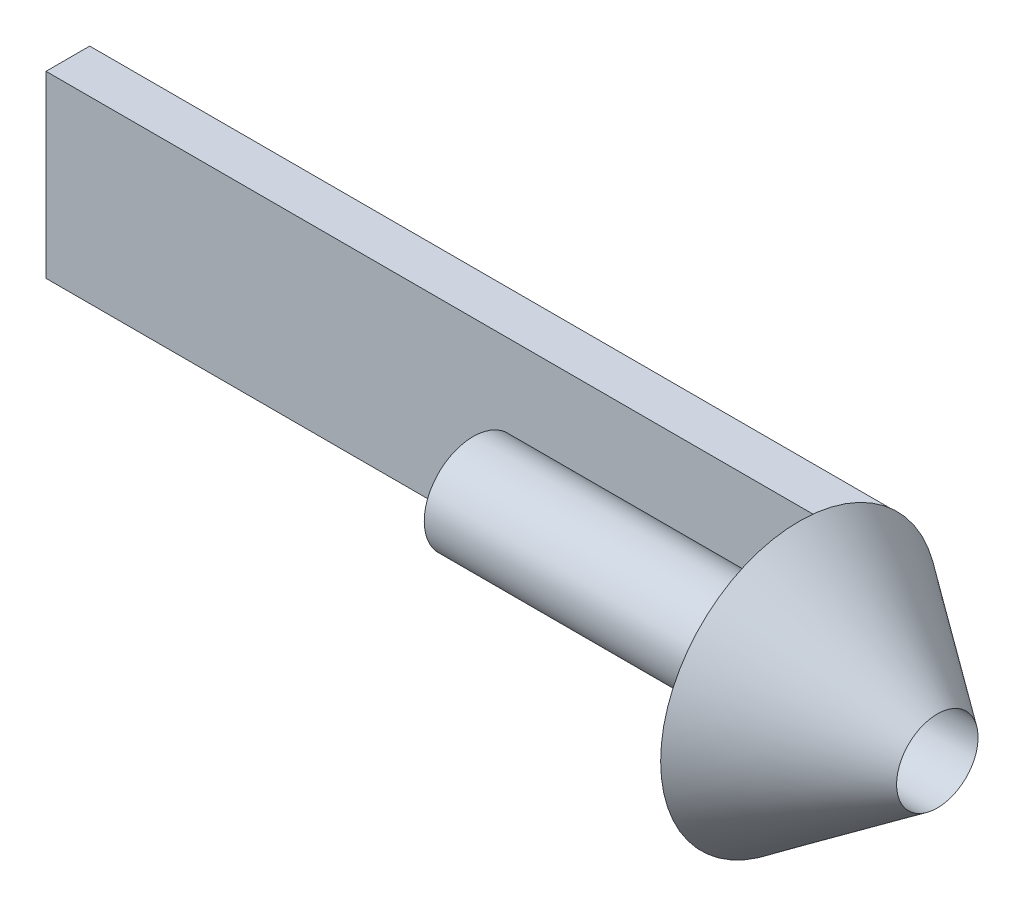
from build123d import *

# Parameters (mm, degrees)
SKETCH_2_R          = 2.5
CUT_EXTRUDE_3_DEPTH = 20
EXTRUDE_START       = 20
SKETCH_4_R          = 3
SKETCH_4_R_2        = 2.5
EXTRUDE_1_DEPTH     = 20
SKETCH_5_W          = 2.680740698
SKETCH_5_H          = 11
EXTRUDE_2_DEPTH     = 50


with BuildPart() as part:
    # 草圖1 → 旋轉2 (revolve)
    with BuildSketch(Plane.XY, mode=Mode.PRIVATE) as revolve_2_sk:
        Polygon((0, 8.5), (0, 0), (12, 0), align=None)
    revolve(revolve_2_sk.sketch.rotate(Axis((0, 0, 0), (1, 0, 0)), 90), axis=Axis((0, 0, 0), (1, 0, 0)))

    # 草圖2 → 除料-伸長3 (cut)
    with BuildSketch(Plane.ZY):
        Circle(SKETCH_2_R)
    extrude(amount=-CUT_EXTRUDE_3_DEPTH, mode=Mode.SUBTRACT)

    # 草圖4 → 填料-伸長1 (add)
    with BuildSketch(Plane.ZY.offset(EXTRUDE_START)):
        with Locations(Location((0, 0, 0), (0, 0, 180))):
            Circle(SKETCH_4_R)
        Circle(SKETCH_4_R_2, mode=Mode.SUBTRACT)
    extrude(amount=-EXTRUDE_1_DEPTH)

    # 草圖5 → 填料-伸長2 (add)
    with BuildSketch(Plane.ZY):
        with Locations((-5.140370349, 0)):
            Rectangle(SKETCH_5_W, SKETCH_5_H)
    extrude(amount=EXTRUDE_2_DEPTH)


solid = part.part
